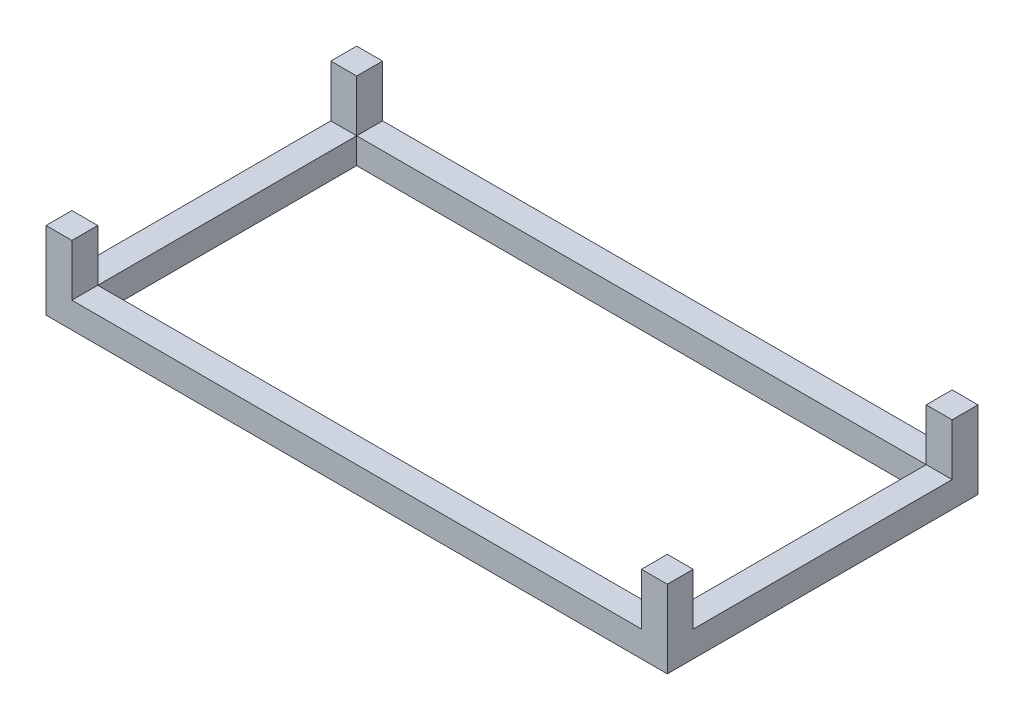
from build123d import *

# Parameters (mm, degrees)
SKETCH2_W           = 152.4
SKETCH2_H           = 76.2
BOSS_EXTRUDE2_DEPTH = 6.35
SKETCH3_W           = 139.7
SKETCH3_H           = 63.5
CUT_EXTRUDE1_DEPTH  = 6.35
SKETCH4_W           = 6.35
SKETCH4_H           = 6.35
BOSS_EXTRUDE3_DEPTH = 12.7


with BuildPart() as part:
    # Sketch2 → Boss-Extrude2 (new body)
    with BuildSketch(Plane(origin=(0, 0, 0), x_dir=(1, 0, 0), z_dir=(0, 1, 0))):
        Rectangle(SKETCH2_W, SKETCH2_H)
    extrude(amount=-BOSS_EXTRUDE2_DEPTH)

    # Sketch3 → Cut-Extrude1 (cut)
    with BuildSketch(Plane(origin=(0, -6.35, 0), x_dir=(-1, 0, 0), z_dir=(0, -1, 0))):
        Rectangle(SKETCH3_W, SKETCH3_H)
    extrude(amount=-CUT_EXTRUDE1_DEPTH, mode=Mode.SUBTRACT)

    # Sketch4 → Boss-Extrude3 (add)
    with BuildSketch(Plane(origin=(0, 0, 0), x_dir=(1, 0, 0), z_dir=(0, 1, 0))):
        with Locations((-73.025, 34.925)):
            Rectangle(SKETCH4_W, SKETCH4_H)
        with Locations((-73.025, -34.925)):
            Rectangle(SKETCH4_W, SKETCH4_H)
        with Locations((73.025, -34.925)):
            Rectangle(SKETCH4_W, SKETCH4_H)
        with Locations((73.025, 34.925)):
            Rectangle(SKETCH4_W, SKETCH4_H)
    extrude(amount=BOSS_EXTRUDE3_DEPTH)


solid = part.part
